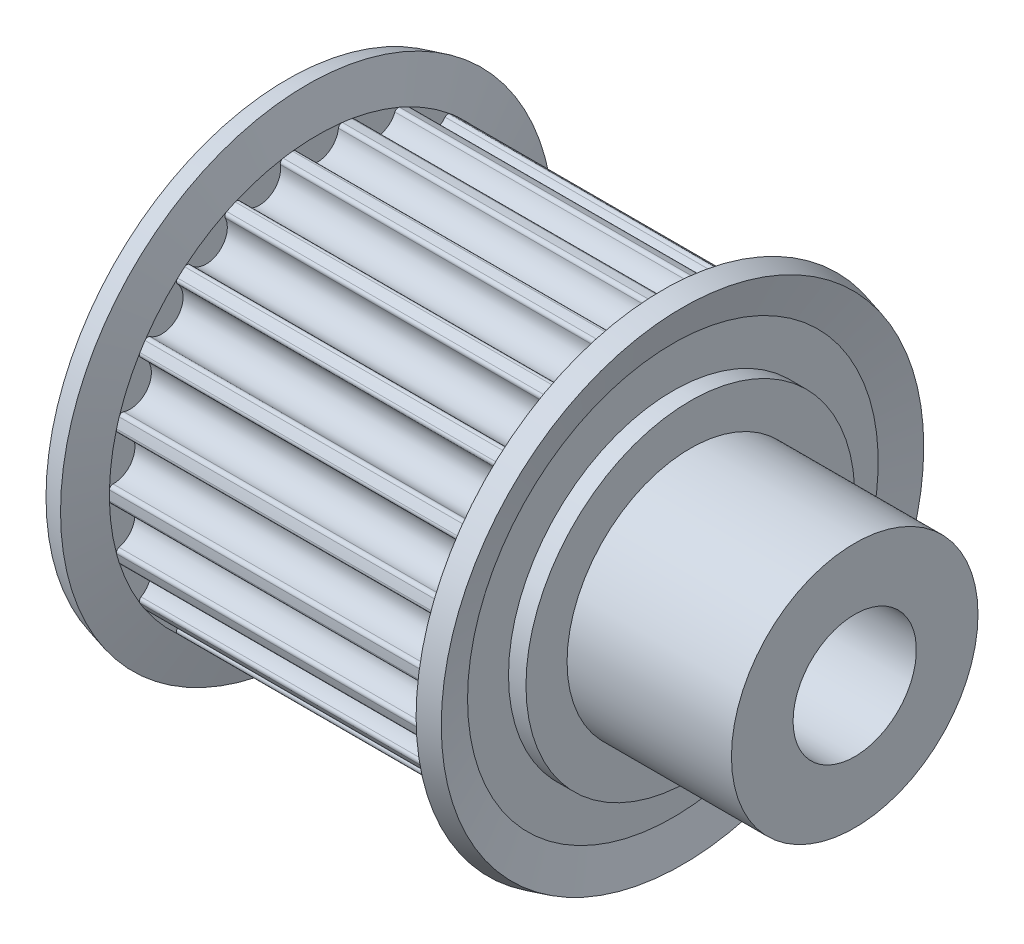
from build123d import *

# Parameters (mm, degrees)
CUT_EXTRUDE1_DEPTH       = 8.15
CUT_EXTRUDE1_DEPTH_BACK  = 8.15
CUT_EXTRUDE2_DEPTH       = 8.15
CUT_EXTRUDE2_DEPTH_BACK  = 8.15
CUT_EXTRUDE3_DEPTH       = 8.15
CUT_EXTRUDE3_DEPTH_BACK  = 8.15
CUT_EXTRUDE4_DEPTH       = 8.15
CUT_EXTRUDE4_DEPTH_BACK  = 8.15
CUT_EXTRUDE5_DEPTH       = 8.15
CUT_EXTRUDE5_DEPTH_BACK  = 8.15
CUT_EXTRUDE6_DEPTH       = 8.15
CUT_EXTRUDE6_DEPTH_BACK  = 8.15
CUT_EXTRUDE7_DEPTH       = 8.15
CUT_EXTRUDE7_DEPTH_BACK  = 8.15
CUT_EXTRUDE8_DEPTH       = 8.15
CUT_EXTRUDE8_DEPTH_BACK  = 8.15
CUT_EXTRUDE9_DEPTH       = 8.15
CUT_EXTRUDE9_DEPTH_BACK  = 8.15
CUT_EXTRUDE10_DEPTH      = 8.15
CUT_EXTRUDE10_DEPTH_BACK = 8.15
CUT_EXTRUDE11_DEPTH      = 8.15
CUT_EXTRUDE11_DEPTH_BACK = 8.15
CUT_EXTRUDE12_DEPTH      = 8.15
CUT_EXTRUDE12_DEPTH_BACK = 8.15
CUT_EXTRUDE13_DEPTH      = 8.15
CUT_EXTRUDE13_DEPTH_BACK = 8.15
CUT_EXTRUDE14_DEPTH      = 8.15
CUT_EXTRUDE14_DEPTH_BACK = 8.15
CUT_EXTRUDE15_DEPTH      = 8.15
CUT_EXTRUDE15_DEPTH_BACK = 8.15
CUT_EXTRUDE16_DEPTH      = 8.15
CUT_EXTRUDE16_DEPTH_BACK = 8.15
CUT_EXTRUDE17_DEPTH      = 8.15
CUT_EXTRUDE17_DEPTH_BACK = 8.15
CUT_EXTRUDE18_DEPTH      = 8.15
CUT_EXTRUDE18_DEPTH_BACK = 8.15
CUT_EXTRUDE19_DEPTH      = 8.15
CUT_EXTRUDE19_DEPTH_BACK = 8.15
CUT_EXTRUDE20_DEPTH      = 8.15
CUT_EXTRUDE20_DEPTH_BACK = 8.15
CUT_EXTRUDE21_DEPTH      = 8.15
CUT_EXTRUDE21_DEPTH_BACK = 8.15
CUT_EXTRUDE22_DEPTH      = 8.15
CUT_EXTRUDE22_DEPTH_BACK = 8.15
SKETCH24_W               = 28
SKETCH24_H               = 3


with BuildPart() as part:
    # Sketch1 → Revolve1 (revolve)
    with BuildSketch(Plane.XY, mode=Mode.PRIVATE) as revolve1_sk:
        Polygon((0, 0), (0, 8), (0.85, 8), (0.85, 9.993347502), (0.381669438, 11.741180955), (1.347595264, 12), (1.85, 10.125), (18.15, 10.125), (18.652404736, 12), (19.618330562, 11.741180955), (19.15, 9.993347502), (19.15, 8), (20, 8), (20, 6), (28, 6), (28, 0), align=None)
    revolve(revolve1_sk.sketch.rotate(Axis((28, 0, 0), (-1, 0, 0)), 270), axis=Axis((28, 0, 0), (-1, 0, 0)))

    # Sketch2 → Cut-Extrude1 (cut, two sides: drawn at the far end of the back side and taken through both)
    with BuildSketch(Plane(origin=(10, 0, 0), x_dir=(0, 0, -1), z_dir=(1, 0, 0)).offset(-CUT_EXTRUDE1_DEPTH_BACK)):
        with BuildLine():
            Line((-1.258647468, 10.429325556), (-1.213118098, 10.052062947))
            ThreePointArc((-1.213118098, 10.052062947), (-1.087134668, 10.016499678), (-1.023776822, 9.901946833))
            ThreePointArc((-1.023776822, 9.901946833), (-1.2e-08, 8.985), (1.023776819, 9.901946809))
            ThreePointArc((1.023776819, 9.901946809), (1.087134658, 10.01649967), (1.213118098, 10.052062947))
            Line((1.213118098, 10.052062947), (1.258647468, 10.429325556))
            ThreePointArc((1.258647468, 10.429325556), (0, 10.505), (-1.258647468, 10.429325556))
        make_face()
    extrude(amount=CUT_EXTRUDE1_DEPTH + CUT_EXTRUDE1_DEPTH_BACK, mode=Mode.SUBTRACT)

    # Sketch3 → Cut-Extrude2 (cut, two sides: drawn at the far end of the back side and taken through both)
    with BuildSketch(Plane(origin=(10, 0, 0), x_dir=(0, 0, -1), z_dir=(1, 0, 0)).offset(-CUT_EXTRUDE2_DEPTH_BACK)):
        with BuildLine():
            Line((-4.145943957, 9.652262621), (-3.995971686, 9.303108904))
            ThreePointArc((-3.995971686, 9.303108904), (-3.86507214, 9.304479831), (-3.772007466, 9.21241715))
            ThreePointArc((-3.772007466, 9.21241715), (-2.531367035, 8.621044365), (-1.807394127, 9.789279649))
            ThreePointArc((-1.807394127, 9.789279649), (-1.778875997, 9.91704228), (-1.668015104, 9.986658631))
            Line((-1.668015104, 9.986658631), (-1.730617153, 10.36146656))
            ThreePointArc((-1.730617153, 10.36146656), (-2.95960051, 10.079473688), (-4.145943957, 9.652262621))
        make_face()
    extrude(amount=CUT_EXTRUDE2_DEPTH + CUT_EXTRUDE2_DEPTH_BACK, mode=Mode.SUBTRACT)

    # Sketch4 → Cut-Extrude3 (cut, two sides: drawn at the far end of the back side and taken through both)
    with BuildSketch(Plane(origin=(10, 0, 0), x_dir=(0, 0, -1), z_dir=(1, 0, 0)).offset(-CUT_EXTRUDE3_DEPTH_BACK)):
        with BuildLine():
            Line((-6.697360723, 8.093230773), (-6.455095414, 7.800472306))
            ThreePointArc((-6.455095414, 7.800472306), (-6.329884454, 7.838666365), (-6.214652499, 7.776552217))
            ThreePointArc((-6.214652499, 7.776552217), (-4.857657755, 7.558662986), (-4.492140751, 8.883543271))
            ThreePointArc((-4.492140751, 8.883543271), (-4.500772698, 9.014165104), (-4.414015643, 9.112194626))
            Line((-4.414015643, 9.112194626), (-4.579677465, 9.454183165))
            ThreePointArc((-4.579677465, 9.454183165), (-5.679431787, 8.837368362), (-6.697360723, 8.093230773))
        make_face()
    extrude(amount=CUT_EXTRUDE3_DEPTH + CUT_EXTRUDE3_DEPTH_BACK, mode=Mode.SUBTRACT)

    # Sketch5 → Cut-Extrude4 (cut, two sides: drawn at the far end of the back side and taken through both)
    with BuildSketch(Plane(origin=(10, 0, 0), x_dir=(0, 0, -1), z_dir=(1, 0, 0)).offset(-CUT_EXTRUDE4_DEPTH_BACK)):
        with BuildLine():
            Line((-8.706197155, 5.8785335), (-8.391265701, 5.665887833))
            ThreePointArc((-8.391265701, 5.665887833), (-8.281887174, 5.737810768), (-8.153823345, 5.710677273))
            ThreePointArc((-8.153823345, 5.710677273), (-6.790409934, 5.883923685), (-6.812960847, 7.25811505))
            ThreePointArc((-6.812960847, 7.25811505), (-6.858043562, 7.381013881), (-6.802418885, 7.499514805))
            Line((-6.802418885, 7.499514805), (-7.057719545, 7.780978077))
            ThreePointArc((-7.057719545, 7.780978077), (-7.939149279, 6.87931201), (-8.706197155, 5.8785335))
        make_face()
    extrude(amount=CUT_EXTRUDE4_DEPTH + CUT_EXTRUDE4_DEPTH_BACK, mode=Mode.SUBTRACT)

    # Sketch6 → Cut-Extrude5 (cut, two sides: drawn at the far end of the back side and taken through both)
    with BuildSketch(Plane(origin=(10, 0, 0), x_dir=(0, 0, -1), z_dir=(1, 0, 0)).offset(-CUT_EXTRUDE5_DEPTH_BACK)):
        with BuildLine():
            Line((-10.00970927, 3.187592403), (-9.647625546, 3.072286824))
            ThreePointArc((-9.647625546, 3.072286824), (-9.56294065, 3.172111867), (-9.432419917, 3.182157219))
            ThreePointArc((-9.432419917, 3.182157219), (-8.173043483, 3.732503881), (-8.581835373, 5.044677513))
            ThreePointArc((-8.581835373, 5.044677513), (-8.659716523, 5.149896809), (-8.639730605, 5.279268896))
            Line((-8.639730605, 5.279268896), (-8.963987161, 5.47740442))
            ThreePointArc((-8.963987161, 5.47740442), (-9.555684111, 4.363934712), (-10.00970927, 3.187592403))
        make_face()
    extrude(amount=CUT_EXTRUDE5_DEPTH + CUT_EXTRUDE5_DEPTH_BACK, mode=Mode.SUBTRACT)

    # Sketch7 → Cut-Extrude6 (cut, two sides: drawn at the far end of the back side and taken through both)
    with BuildSketch(Plane(origin=(10, 0, 0), x_dir=(0, 0, -1), z_dir=(1, 0, 0)).offset(-CUT_EXTRUDE6_DEPTH_BACK)):
        with BuildLine():
            Line((-10.50229427, 0.238411528), (-10.122392145, 0.229787408))
            ThreePointArc((-10.122392145, 0.229787408), (-10.069261548, 0.349427327), (-9.946857924, 0.395837712))
            ThreePointArc((-9.946857924, 0.395837712), (-8.893545657, 1.27869881), (-9.655460635, 2.422550206))
            ThreePointArc((-9.655460635, 2.422550206), (-9.759830753, 2.501565725), (-9.777102734, 2.631328017))
            Line((-9.777102734, 2.631328017), (-10.144045849, 2.730084032))
            ThreePointArc((-10.144045849, 2.730084032), (-10.398074247, 1.495017376), (-10.50229427, 0.238411528))
        make_face()
    extrude(amount=CUT_EXTRUDE6_DEPTH + CUT_EXTRUDE6_DEPTH_BACK, mode=Mode.SUBTRACT)

    # Sketch8 → Cut-Extrude7 (cut, two sides: drawn at the far end of the back side and taken through both)
    with BuildSketch(Plane(origin=(10, 0, 0), x_dir=(0, 0, -1), z_dir=(1, 0, 0)).offset(-CUT_EXTRUDE7_DEPTH_BACK)):
        with BuildLine():
            Line((-10.144045849, -2.730084032), (-9.777102734, -2.631328017))
            ThreePointArc((-9.777102734, -2.631328017), (-9.759830759, -2.501565736), (-9.655460659, -2.422550212))
            ThreePointArc((-9.655460659, -2.422550212), (-8.893545654, -1.278698834), (-9.9468579, -0.395837711))
            ThreePointArc((-9.9468579, -0.395837711), (-10.069261539, -0.349427336), (-10.122392145, -0.229787408))
            Line((-10.122392145, -0.229787408), (-10.50229427, -0.238411528))
            ThreePointArc((-10.50229427, -0.238411528), (-10.398074247, -1.495017376), (-10.144045849, -2.730084032))
        make_face()
    extrude(amount=CUT_EXTRUDE7_DEPTH + CUT_EXTRUDE7_DEPTH_BACK, mode=Mode.SUBTRACT)

    # Sketch9 → Cut-Extrude8 (cut, two sides: drawn at the far end of the back side and taken through both)
    with BuildSketch(Plane(origin=(10, 0, 0), x_dir=(0, 0, -1), z_dir=(1, 0, 0)).offset(-CUT_EXTRUDE8_DEPTH_BACK)):
        with BuildLine():
            Line((-8.963987161, -5.47740442), (-8.639730605, -5.279268896))
            ThreePointArc((-8.639730605, -5.279268896), (-8.659716526, -5.149896821), (-8.581835394, -5.044677526))
            ThreePointArc((-8.581835394, -5.044677526), (-8.173043473, -3.732503903), (-9.432419894, -3.182157211))
            ThreePointArc((-9.432419894, -3.182157211), (-9.562940639, -3.172111872), (-9.647625546, -3.072286824))
            Line((-9.647625546, -3.072286824), (-10.00970927, -3.187592403))
            ThreePointArc((-10.00970927, -3.187592403), (-9.555684111, -4.363934712), (-8.963987161, -5.47740442))
        make_face()
    extrude(amount=CUT_EXTRUDE8_DEPTH + CUT_EXTRUDE8_DEPTH_BACK, mode=Mode.SUBTRACT)

    # Sketch10 → Cut-Extrude9 (cut, two sides: drawn at the far end of the back side and taken through both)
    with BuildSketch(Plane(origin=(10, 0, 0), x_dir=(0, 0, -1), z_dir=(1, 0, 0)).offset(-CUT_EXTRUDE9_DEPTH_BACK)):
        with BuildLine():
            Line((-7.057719545, -7.780978077), (-6.802418885, -7.499514805))
            ThreePointArc((-6.802418885, -7.499514805), (-6.858043561, -7.381013893), (-6.812960863, -7.258115068))
            ThreePointArc((-6.812960863, -7.258115068), (-6.790409918, -5.883923704), (-8.153823325, -5.710677259))
            ThreePointArc((-8.153823325, -5.710677259), (-8.281887162, -5.73781077), (-8.391265701, -5.665887833))
            Line((-8.391265701, -5.665887833), (-8.706197155, -5.8785335))
            ThreePointArc((-8.706197155, -5.8785335), (-7.939149279, -6.87931201), (-7.057719545, -7.780978077))
        make_face()
    extrude(amount=CUT_EXTRUDE9_DEPTH + CUT_EXTRUDE9_DEPTH_BACK, mode=Mode.SUBTRACT)

    # Sketch11 → Cut-Extrude10 (cut, two sides: drawn at the far end of the back side and taken through both)
    with BuildSketch(Plane(origin=(10, 0, 0), x_dir=(0, 0, -1), z_dir=(1, 0, 0)).offset(-CUT_EXTRUDE10_DEPTH_BACK)):
        with BuildLine():
            Line((-4.579677465, -9.454183165), (-4.414015643, -9.112194626))
            ThreePointArc((-4.414015643, -9.112194626), (-4.500772694, -9.014165116), (-4.492140762, -8.883543293))
            ThreePointArc((-4.492140762, -8.883543293), (-4.857657735, -7.558662999), (-6.214652483, -7.776552198))
            ThreePointArc((-6.214652483, -7.776552198), (-6.329884441, -7.838666364), (-6.455095414, -7.800472306))
            Line((-6.455095414, -7.800472306), (-6.697360723, -8.093230773))
            ThreePointArc((-6.697360723, -8.093230773), (-5.679431787, -8.837368362), (-4.579677465, -9.454183165))
        make_face()
    extrude(amount=CUT_EXTRUDE10_DEPTH + CUT_EXTRUDE10_DEPTH_BACK, mode=Mode.SUBTRACT)

    # Sketch12 → Cut-Extrude11 (cut, two sides: drawn at the far end of the back side and taken through both)
    with BuildSketch(Plane(origin=(10, 0, 0), x_dir=(0, 0, -1), z_dir=(1, 0, 0)).offset(-CUT_EXTRUDE11_DEPTH_BACK)):
        with BuildLine():
            Line((-1.730617153, -10.36146656), (-1.668015104, -9.986658631))
            ThreePointArc((-1.668015104, -9.986658631), (-1.77887599, -9.91704229), (-1.807394132, -9.789279673))
            ThreePointArc((-1.807394132, -9.789279673), (-2.531367012, -8.621044371), (-3.772007457, -9.212417127))
            ThreePointArc((-3.772007457, -9.212417127), (-3.865072128, -9.304479827), (-3.995971686, -9.303108904))
            Line((-3.995971686, -9.303108904), (-4.145943957, -9.652262621))
            ThreePointArc((-4.145943957, -9.652262621), (-2.95960051, -10.079473688), (-1.730617153, -10.36146656))
        make_face()
    extrude(amount=CUT_EXTRUDE11_DEPTH + CUT_EXTRUDE11_DEPTH_BACK, mode=Mode.SUBTRACT)

    # Sketch13 → Cut-Extrude12 (cut, two sides: drawn at the far end of the back side and taken through both)
    with BuildSketch(Plane(origin=(10, 0, 0), x_dir=(0, 0, -1), z_dir=(1, 0, 0)).offset(-CUT_EXTRUDE12_DEPTH_BACK)):
        with BuildLine():
            Line((1.258647468, -10.429325556), (1.213118098, -10.052062947))
            ThreePointArc((1.213118098, -10.052062947), (1.087134668, -10.016499678), (1.023776822, -9.901946833))
            ThreePointArc((1.023776822, -9.901946833), (1.2e-08, -8.985), (-1.023776819, -9.901946809))
            ThreePointArc((-1.023776819, -9.901946809), (-1.087134658, -10.01649967), (-1.213118098, -10.052062947))
            Line((-1.213118098, -10.052062947), (-1.258647468, -10.429325556))
            ThreePointArc((-1.258647468, -10.429325556), (0, -10.505), (1.258647468, -10.429325556))
        make_face()
    extrude(amount=CUT_EXTRUDE12_DEPTH + CUT_EXTRUDE12_DEPTH_BACK, mode=Mode.SUBTRACT)

    # Sketch14 → Cut-Extrude13 (cut, two sides: drawn at the far end of the back side and taken through both)
    with BuildSketch(Plane(origin=(10, 0, 0), x_dir=(0, 0, -1), z_dir=(1, 0, 0)).offset(-CUT_EXTRUDE13_DEPTH_BACK)):
        with BuildLine():
            Line((4.145943957, -9.652262621), (3.995971686, -9.303108904))
            ThreePointArc((3.995971686, -9.303108904), (3.86507214, -9.304479831), (3.772007466, -9.21241715))
            ThreePointArc((3.772007466, -9.21241715), (2.531367035, -8.621044365), (1.807394127, -9.789279649))
            ThreePointArc((1.807394127, -9.789279649), (1.778875997, -9.91704228), (1.668015104, -9.986658631))
            Line((1.668015104, -9.986658631), (1.730617153, -10.36146656))
            ThreePointArc((1.730617153, -10.36146656), (2.95960051, -10.079473688), (4.145943957, -9.652262621))
        make_face()
    extrude(amount=CUT_EXTRUDE13_DEPTH + CUT_EXTRUDE13_DEPTH_BACK, mode=Mode.SUBTRACT)

    # Sketch15 → Cut-Extrude14 (cut, two sides: drawn at the far end of the back side and taken through both)
    with BuildSketch(Plane(origin=(10, 0, 0), x_dir=(0, 0, -1), z_dir=(1, 0, 0)).offset(-CUT_EXTRUDE14_DEPTH_BACK)):
        with BuildLine():
            Line((6.697360723, -8.093230773), (6.455095414, -7.800472306))
            ThreePointArc((6.455095414, -7.800472306), (6.329884454, -7.838666365), (6.214652499, -7.776552217))
            ThreePointArc((6.214652499, -7.776552217), (4.857657755, -7.558662986), (4.492140751, -8.883543271))
            ThreePointArc((4.492140751, -8.883543271), (4.500772698, -9.014165104), (4.414015643, -9.112194626))
            Line((4.414015643, -9.112194626), (4.579677465, -9.454183165))
            ThreePointArc((4.579677465, -9.454183165), (5.679431787, -8.837368362), (6.697360723, -8.093230773))
        make_face()
    extrude(amount=CUT_EXTRUDE14_DEPTH + CUT_EXTRUDE14_DEPTH_BACK, mode=Mode.SUBTRACT)

    # Sketch16 → Cut-Extrude15 (cut, two sides: drawn at the far end of the back side and taken through both)
    with BuildSketch(Plane(origin=(10, 0, 0), x_dir=(0, 0, -1), z_dir=(1, 0, 0)).offset(-CUT_EXTRUDE15_DEPTH_BACK)):
        with BuildLine():
            Line((8.706197155, -5.8785335), (8.391265701, -5.665887833))
            ThreePointArc((8.391265701, -5.665887833), (8.281887174, -5.737810768), (8.153823345, -5.710677273))
            ThreePointArc((8.153823345, -5.710677273), (6.790409934, -5.883923685), (6.812960847, -7.25811505))
            ThreePointArc((6.812960847, -7.25811505), (6.858043562, -7.381013881), (6.802418885, -7.499514805))
            Line((6.802418885, -7.499514805), (7.057719545, -7.780978077))
            ThreePointArc((7.057719545, -7.780978077), (7.939149279, -6.87931201), (8.706197155, -5.8785335))
        make_face()
    extrude(amount=CUT_EXTRUDE15_DEPTH + CUT_EXTRUDE15_DEPTH_BACK, mode=Mode.SUBTRACT)

    # Sketch17 → Cut-Extrude16 (cut, two sides: drawn at the far end of the back side and taken through both)
    with BuildSketch(Plane(origin=(10, 0, 0), x_dir=(0, 0, -1), z_dir=(1, 0, 0)).offset(-CUT_EXTRUDE16_DEPTH_BACK)):
        with BuildLine():
            Line((10.00970927, -3.187592403), (9.647625546, -3.072286824))
            ThreePointArc((9.647625546, -3.072286824), (9.56294065, -3.172111867), (9.432419917, -3.182157219))
            ThreePointArc((9.432419917, -3.182157219), (8.173043483, -3.732503881), (8.581835373, -5.044677513))
            ThreePointArc((8.581835373, -5.044677513), (8.659716523, -5.149896809), (8.639730605, -5.279268896))
            Line((8.639730605, -5.279268896), (8.963987161, -5.47740442))
            ThreePointArc((8.963987161, -5.47740442), (9.555684111, -4.363934712), (10.00970927, -3.187592403))
        make_face()
    extrude(amount=CUT_EXTRUDE16_DEPTH + CUT_EXTRUDE16_DEPTH_BACK, mode=Mode.SUBTRACT)

    # Sketch18 → Cut-Extrude17 (cut, two sides: drawn at the far end of the back side and taken through both)
    with BuildSketch(Plane(origin=(10, 0, 0), x_dir=(0, 0, -1), z_dir=(1, 0, 0)).offset(-CUT_EXTRUDE17_DEPTH_BACK)):
        with BuildLine():
            Line((10.50229427, -0.238411528), (10.122392145, -0.229787408))
            ThreePointArc((10.122392145, -0.229787408), (10.069261548, -0.349427327), (9.946857924, -0.395837712))
            ThreePointArc((9.946857924, -0.395837712), (8.893545657, -1.27869881), (9.655460635, -2.422550206))
            ThreePointArc((9.655460635, -2.422550206), (9.759830753, -2.501565725), (9.777102734, -2.631328017))
            Line((9.777102734, -2.631328017), (10.144045849, -2.730084032))
            ThreePointArc((10.144045849, -2.730084032), (10.398074247, -1.495017376), (10.50229427, -0.238411528))
        make_face()
    extrude(amount=CUT_EXTRUDE17_DEPTH + CUT_EXTRUDE17_DEPTH_BACK, mode=Mode.SUBTRACT)

    # Sketch19 → Cut-Extrude18 (cut, two sides: drawn at the far end of the back side and taken through both)
    with BuildSketch(Plane(origin=(10, 0, 0), x_dir=(0, 0, -1), z_dir=(1, 0, 0)).offset(-CUT_EXTRUDE18_DEPTH_BACK)):
        with BuildLine():
            Line((10.144045849, 2.730084032), (9.777102734, 2.631328017))
            ThreePointArc((9.777102734, 2.631328017), (9.759830759, 2.501565736), (9.655460659, 2.422550212))
            ThreePointArc((9.655460659, 2.422550212), (8.893545654, 1.278698834), (9.9468579, 0.395837711))
            ThreePointArc((9.9468579, 0.395837711), (10.069261539, 0.349427336), (10.122392145, 0.229787408))
            Line((10.122392145, 0.229787408), (10.50229427, 0.238411528))
            ThreePointArc((10.50229427, 0.238411528), (10.398074247, 1.495017376), (10.144045849, 2.730084032))
        make_face()
    extrude(amount=CUT_EXTRUDE18_DEPTH + CUT_EXTRUDE18_DEPTH_BACK, mode=Mode.SUBTRACT)

    # Sketch20 → Cut-Extrude19 (cut, two sides: drawn at the far end of the back side and taken through both)
    with BuildSketch(Plane(origin=(10, 0, 0), x_dir=(0, 0, -1), z_dir=(1, 0, 0)).offset(-CUT_EXTRUDE19_DEPTH_BACK)):
        with BuildLine():
            Line((8.963987161, 5.47740442), (8.639730605, 5.279268896))
            ThreePointArc((8.639730605, 5.279268896), (8.659716526, 5.149896821), (8.581835394, 5.044677526))
            ThreePointArc((8.581835394, 5.044677526), (8.173043473, 3.732503903), (9.432419894, 3.182157211))
            ThreePointArc((9.432419894, 3.182157211), (9.562940639, 3.172111872), (9.647625546, 3.072286824))
            Line((9.647625546, 3.072286824), (10.00970927, 3.187592403))
            ThreePointArc((10.00970927, 3.187592403), (9.555684111, 4.363934712), (8.963987161, 5.47740442))
        make_face()
    extrude(amount=CUT_EXTRUDE19_DEPTH + CUT_EXTRUDE19_DEPTH_BACK, mode=Mode.SUBTRACT)

    # Sketch21 → Cut-Extrude20 (cut, two sides: drawn at the far end of the back side and taken through both)
    with BuildSketch(Plane(origin=(10, 0, 0), x_dir=(0, 0, -1), z_dir=(1, 0, 0)).offset(-CUT_EXTRUDE20_DEPTH_BACK)):
        with BuildLine():
            Line((7.057719545, 7.780978077), (6.802418885, 7.499514805))
            ThreePointArc((6.802418885, 7.499514805), (6.858043561, 7.381013893), (6.812960863, 7.258115068))
            ThreePointArc((6.812960863, 7.258115068), (6.790409918, 5.883923704), (8.153823325, 5.710677259))
            ThreePointArc((8.153823325, 5.710677259), (8.281887162, 5.73781077), (8.391265701, 5.665887833))
            Line((8.391265701, 5.665887833), (8.706197155, 5.8785335))
            ThreePointArc((8.706197155, 5.8785335), (7.939149279, 6.87931201), (7.057719545, 7.780978077))
        make_face()
    extrude(amount=CUT_EXTRUDE20_DEPTH + CUT_EXTRUDE20_DEPTH_BACK, mode=Mode.SUBTRACT)

    # Sketch22 → Cut-Extrude21 (cut, two sides: drawn at the far end of the back side and taken through both)
    with BuildSketch(Plane(origin=(10, 0, 0), x_dir=(0, 0, -1), z_dir=(1, 0, 0)).offset(-CUT_EXTRUDE21_DEPTH_BACK)):
        with BuildLine():
            Line((4.579677465, 9.454183165), (4.414015643, 9.112194626))
            ThreePointArc((4.414015643, 9.112194626), (4.500772694, 9.014165116), (4.492140762, 8.883543293))
            ThreePointArc((4.492140762, 8.883543293), (4.857657735, 7.558662999), (6.214652483, 7.776552198))
            ThreePointArc((6.214652483, 7.776552198), (6.329884441, 7.838666364), (6.455095414, 7.800472306))
            Line((6.455095414, 7.800472306), (6.697360723, 8.093230773))
            ThreePointArc((6.697360723, 8.093230773), (5.679431787, 8.837368362), (4.579677465, 9.454183165))
        make_face()
    extrude(amount=CUT_EXTRUDE21_DEPTH + CUT_EXTRUDE21_DEPTH_BACK, mode=Mode.SUBTRACT)

    # Sketch23 → Cut-Extrude22 (cut, two sides: drawn at the far end of the back side and taken through both)
    with BuildSketch(Plane(origin=(10, 0, 0), x_dir=(0, 0, -1), z_dir=(1, 0, 0)).offset(-CUT_EXTRUDE22_DEPTH_BACK)):
        with BuildLine():
            Line((1.730617153, 10.36146656), (1.668015104, 9.986658631))
            ThreePointArc((1.668015104, 9.986658631), (1.77887599, 9.91704229), (1.807394132, 9.789279673))
            ThreePointArc((1.807394132, 9.789279673), (2.531367012, 8.621044371), (3.772007457, 9.212417127))
            ThreePointArc((3.772007457, 9.212417127), (3.865072128, 9.304479827), (3.995971686, 9.303108904))
            Line((3.995971686, 9.303108904), (4.145943957, 9.652262621))
            ThreePointArc((4.145943957, 9.652262621), (2.95960051, 10.079473688), (1.730617153, 10.36146656))
        make_face()
    extrude(amount=CUT_EXTRUDE22_DEPTH + CUT_EXTRUDE22_DEPTH_BACK, mode=Mode.SUBTRACT)

    # Sketch24 → Cut-Revolve1 (revolve, cut)
    with BuildSketch(Plane.XY, mode=Mode.PRIVATE) as cut_revolve1_sk:
        with Locations((14, 1.5)):
            Rectangle(SKETCH24_W, SKETCH24_H)
    revolve(cut_revolve1_sk.sketch.rotate(Axis((28, 0, 0), (-1, 0, 0)), 88.699557617), axis=Axis((28, 0, 0), (-1, 0, 0)), mode=Mode.SUBTRACT)


solid = part.part
